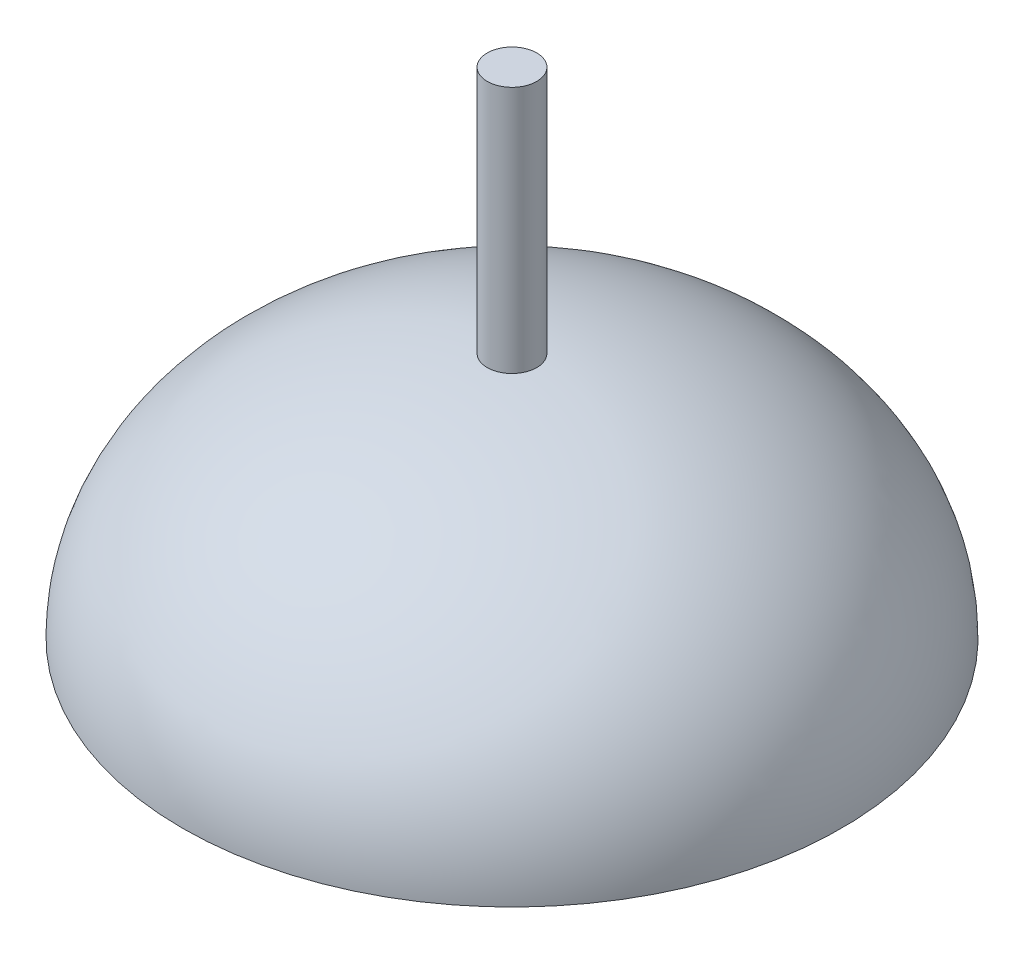
from build123d import *

# Parameters (mm, degrees)
ESTRUSIONE_ESTRUSIONE1_DEPTH      = 600
ESTRUSIONE_ESTRUSIONE1_DEPTH_BACK = 100
SCHIZZO6_R                        = 30
SCHIZZO7_R                        = 49.111274452
ESTRUSIONE_ESTRUSIONE2_DEPTH      = 10


with BuildPart() as part:
    # Schizzo1 → Rivoluzione2 (revolve)
    with BuildSketch(Plane.XY):
        with BuildLine():
            Line((0, 280.99750454), (0, 300))
            add(Edge.make_bspline(
                [(400, 0), (400, 300), (0, 300)],
                knots=[0, 0, 0, 1.570796327, 1.570796327, 1.570796327], degree=2, weights=[1, 0.707106781, 1]))
            Line((400, 0), (377.926101554, 0))
            add(Edge.make_bspline(
                [(377.926101554, 0), (377.926101554, 280.99750454), (0, 280.99750454)],
                knots=[0, 0, 0, 1.570796327, 1.570796327, 1.570796327], degree=2, weights=[1, 0.707106781, 1]))
        make_face()
    revolve(axis=Axis((0, 300, 0), (0, -1, 0)))

    # Schizzo6 → Estrusione-Estrusione1 (add, two sides: drawn at the far end of the back side and taken through both)
    with BuildSketch(Plane(origin=(0, 0, 0), x_dir=(1, 0, 0), z_dir=(0, 1, 0)).offset(-ESTRUSIONE_ESTRUSIONE1_DEPTH_BACK)):
        with Locations(Location((0, 0, 0), (0, 0, 270))):
            Circle(SCHIZZO6_R)
    extrude(amount=ESTRUSIONE_ESTRUSIONE1_DEPTH + ESTRUSIONE_ESTRUSIONE1_DEPTH_BACK)

    # Schizzo7 → Estrusione-Estrusione2 (add)
    with BuildSketch(Plane.XZ.offset(100)):
        with Locations(Location((0, 0, 0), (0, 0, 270))):
            Circle(SCHIZZO7_R)
    extrude(amount=ESTRUSIONE_ESTRUSIONE2_DEPTH)


solid = part.part
